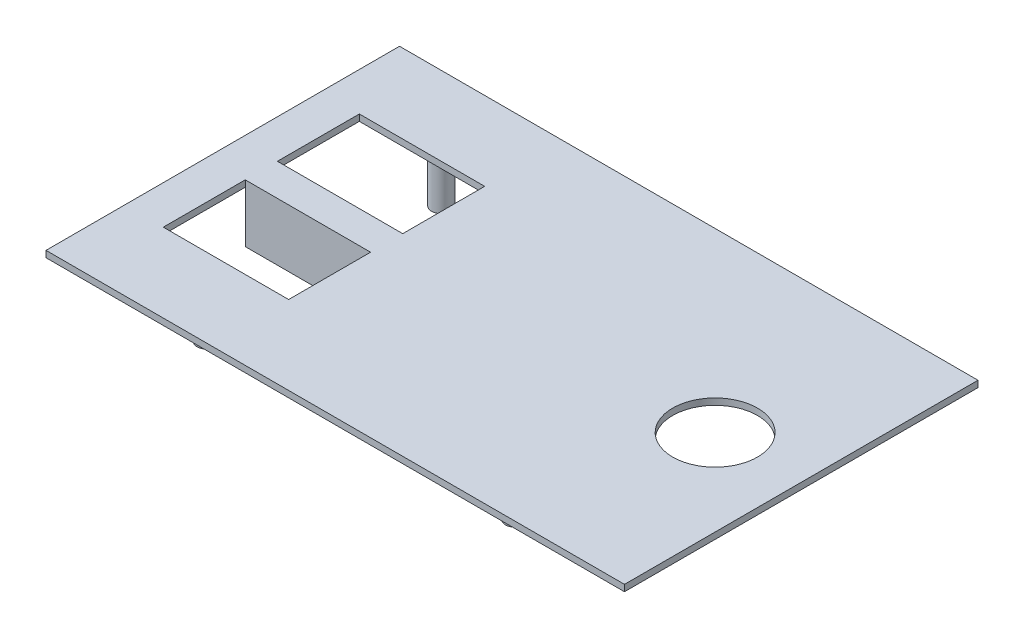
from build123d import *

# Parameters (mm, degrees)
SKETCH1_W           = 90
SKETCH1_H           = 55
BOSS_EXTRUDE1_DEPTH = 1
SKETCH2_R           = 6.6
SKETCH2_W           = 19.5
SKETCH2_H           = 12.75
CUT_EXTRUDE1_DEPTH  = 106.479855897
SKETCH3_R           = 1.5
SKETCH3_R_2         = 0.194235627
SKETCH3_W           = 19.5
SKETCH3_H           = 5
BOSS_EXTRUDE4_DEPTH = 8


with BuildPart() as part:
    # Sketch1 → Boss-Extrude1 (new body)
    with BuildSketch(Plane(origin=(0, 0, 0), x_dir=(1, 0, 0), z_dir=(0, 1, 0))):
        with Locations((45, 27.5)):
            Rectangle(SKETCH1_W, SKETCH1_H)
    extrude(amount=BOSS_EXTRUDE1_DEPTH)

    # Sketch2 → Cut-Extrude1 (cut, through all)
    with BuildSketch(Plane(origin=(0, 1, 0), x_dir=(1, 0, 0), z_dir=(0, 1, 0))):
        with Locations((76.6, 27.5)):
            Circle(SKETCH2_R)
        with Locations((15.75, 36.375)):
            Rectangle(SKETCH2_W, SKETCH2_H)
        with Locations((15.75, 18.625)):
            Rectangle(SKETCH2_W, SKETCH2_H)
    extrude(amount=-CUT_EXTRUDE1_DEPTH, mode=Mode.SUBTRACT)

    # Sketch3 → Boss-Extrude4 (add)
    # profile 1 of 7: a face of its own
    with BuildSketch(Plane.XZ):
        with Locations((15.75, -9.25)):
            Circle(SKETCH3_R)
        with Locations((15.75, -9.25)):
            Circle(SKETCH3_R_2, mode=Mode.SUBTRACT)
    # profile 2 of 7: a face of its own
    with BuildSketch(Plane.XZ):
        with Locations((15.75, -45.75)):
            Circle(SKETCH3_R)
    # profile 3 of 7: a face of its own
    with BuildSketch(Plane.XZ):
        with Locations((63.75, -9.25)):
            Circle(SKETCH3_R)
    # profile 4 of 7: a face of its own
    with BuildSketch(Plane.XZ):
        with Locations((63.75, -45.75)):
            Circle(SKETCH3_R)
    # profile 5 of 7: a face of its own
    with BuildSketch(Plane.XZ):
        with Locations((63.75, -27.411126752)):
            Circle(SKETCH3_R)
    # profile 6 of 7: a face of its own
    with BuildSketch(Plane.XZ):
        with Locations((42.289365933, -27.411126752)):
            Circle(SKETCH3_R)
    # profile 7 of 7: a face of its own
    with BuildSketch(Plane.XZ):
        with Locations((15.75, -27.5)):
            Rectangle(SKETCH3_W, SKETCH3_H)
    extrude(amount=BOSS_EXTRUDE4_DEPTH)


solid = part.part
